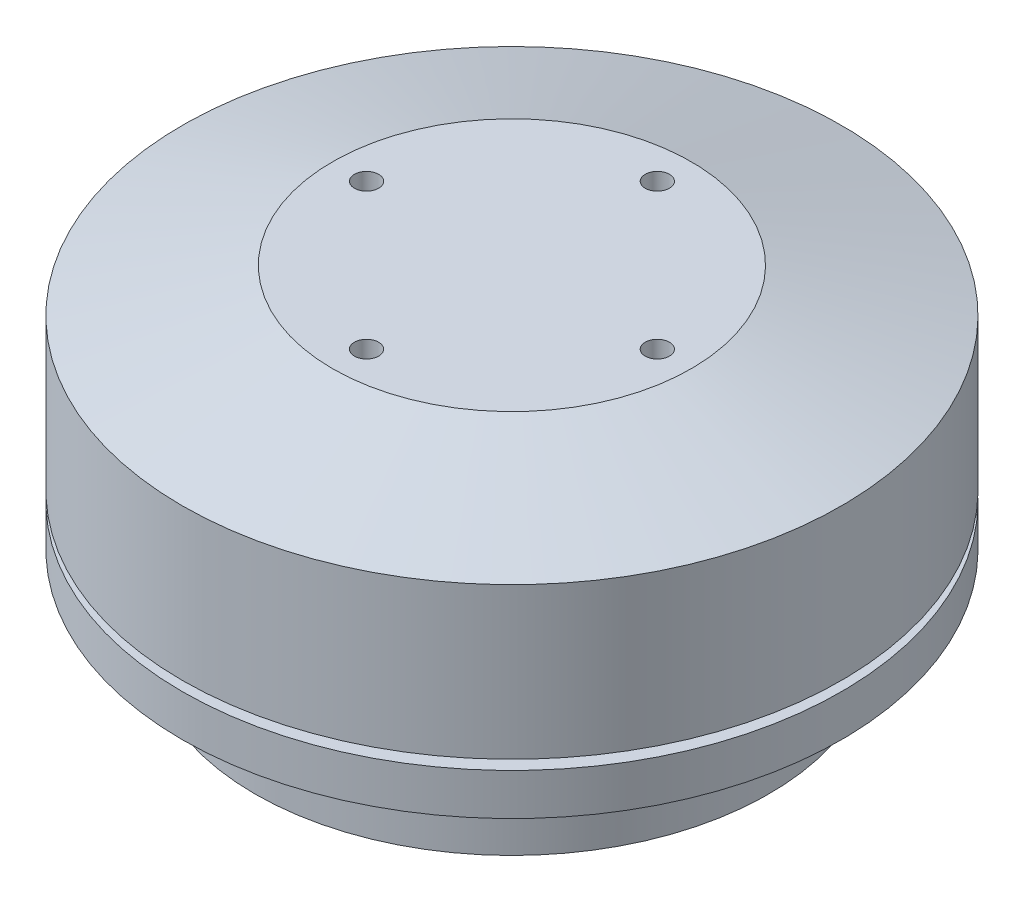
from build123d import *

# Parameters (mm, degrees)
M3X0_5_TAPPED_HOLE1_D     = 2.5
M3X0_5_TAPPED_HOLE1_DEPTH = 6
M3X0_5_TAPPED_HOLE1_TIP   = 0.751075774
M3X0_5_TAPPED_HOLE2_D     = 2.5
M3X0_5_TAPPED_HOLE2_DEPTH = 8.5
M3X0_5_TAPPED_HOLE2_TIP   = 0.751075774


with BuildPart() as part:
    # Sketch1 → Revolve1 (revolve)
    with BuildSketch(Plane.XY):
        Polygon((0, 0), (0, 34), (-18.5, 34), (-34, 29.5), (-34, 13.9), (-32.520474493, 13.9), (-32.520474493, 12.9), (-34, 12.9), (-34, 8.6), (-26.5, 5.6), (-26.5, 0), align=None)
    revolve(axis=Axis((0, 0, 0), (0, -1, 0)))

    # M3x0.5 Tapped Hole1
    with Locations(Plane(origin=(0, 34, 0), x_dir=(1, 0, 0), z_dir=(0, 1, 0))):
        with Locations((0, 15), (-15, 0), (15, 0), (0, -15)):
            Hole(M3X0_5_TAPPED_HOLE1_D / 2, depth=M3X0_5_TAPPED_HOLE1_DEPTH)
            with Locations((0, 0, -(M3X0_5_TAPPED_HOLE1_DEPTH + M3X0_5_TAPPED_HOLE1_TIP / 2))):  # 118° drill point
                Cone(0, M3X0_5_TAPPED_HOLE1_D / 2, M3X0_5_TAPPED_HOLE1_TIP, mode=Mode.SUBTRACT)

    # M3x0.5 Tapped Hole2
    with Locations(Plane(origin=(0, 0, 0), x_dir=(-1, 0, 0), z_dir=(0, -1, 0))):
        with Locations((0, 15), (0, -15), (15, 0), (-15, 0)):
            Hole(M3X0_5_TAPPED_HOLE2_D / 2, depth=M3X0_5_TAPPED_HOLE2_DEPTH)
            with Locations((0, 0, -(M3X0_5_TAPPED_HOLE2_DEPTH + M3X0_5_TAPPED_HOLE2_TIP / 2))):  # 118° drill point
                Cone(0, M3X0_5_TAPPED_HOLE2_D / 2, M3X0_5_TAPPED_HOLE2_TIP, mode=Mode.SUBTRACT)


solid = part.part
